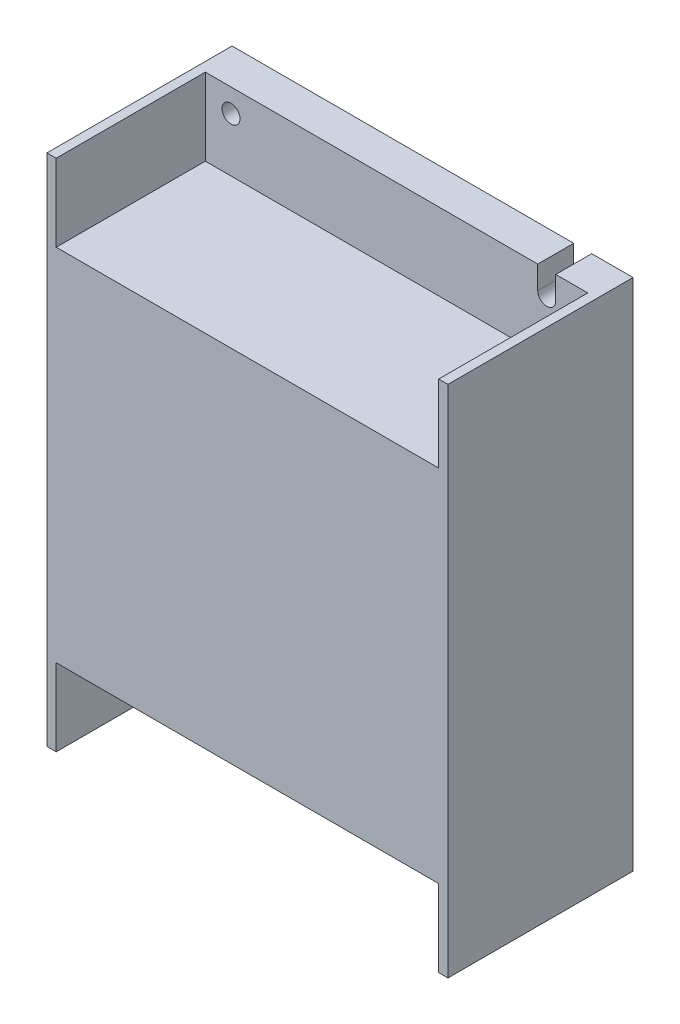
from build123d import *

# Parameters (mm, degrees)
SKETCH_1_W          = 78
SKETCH_1_H          = 100
EXTRUDE_1_DEPTH     = 36
SKETCH_2_W          = 74.4
SKETCH_2_H          = 15
CUT_EXTRUDE_1_DEPTH = 29
SKETCH_4_R          = 1.75
CUT_EXTRUDE_2_DEPTH = 10


with BuildPart() as part:
    # 草图1 → 凸台-拉伸1 (new body)
    with BuildSketch(Plane.XY):
        Rectangle(SKETCH_1_W, SKETCH_1_H)
    extrude(amount=EXTRUDE_1_DEPTH)

    # 草图2 → 切除-拉伸1 (cut)
    with BuildSketch(Plane.XY.offset(36)):
        with Locations((0, 42.5)):
            Rectangle(SKETCH_2_W, SKETCH_2_H)
    cut_extrude_1 = extrude(amount=-CUT_EXTRUDE_1_DEPTH, mode=Mode.SUBTRACT)

    # 草图4 → 切除-拉伸2 (cut)
    with BuildSketch(Plane(origin=(0, 0, 0), x_dir=(-1, 0, 0), z_dir=(0, 0, -1))):
        with Locations((-32.199434729, -45.5)):
            Circle(SKETCH_4_R)
        with Locations((32.199434729, 45.5)):
            Circle(SKETCH_4_R)
        with BuildLine():
            Line((27.464507609, -45.5), (27.464507609, -50))
            Line((27.464507609, -50), (30.964507609, -50))
            Line((30.964507609, -50), (30.964507609, -45.5))
            ThreePointArc((30.964507609, -45.5), (29.214507609, -43.75), (27.464507609, -45.5))
        make_face()
        with BuildLine():
            Line((-27.464507609, 45.5), (-27.464507609, 50))
            Line((-27.464507609, 50), (-30.964507609, 50))
            Line((-30.964507609, 50), (-30.964507609, 45.5))
            ThreePointArc((-30.964507609, 45.5), (-29.214507609, 43.75), (-27.464507609, 45.5))
        make_face()
    extrude(amount=-CUT_EXTRUDE_2_DEPTH, mode=Mode.SUBTRACT)

    # 镜向1: 切除-拉伸1 across plane
    add(cut_extrude_1.mirror(Plane.ZX), mode=Mode.SUBTRACT)


solid = part.part
